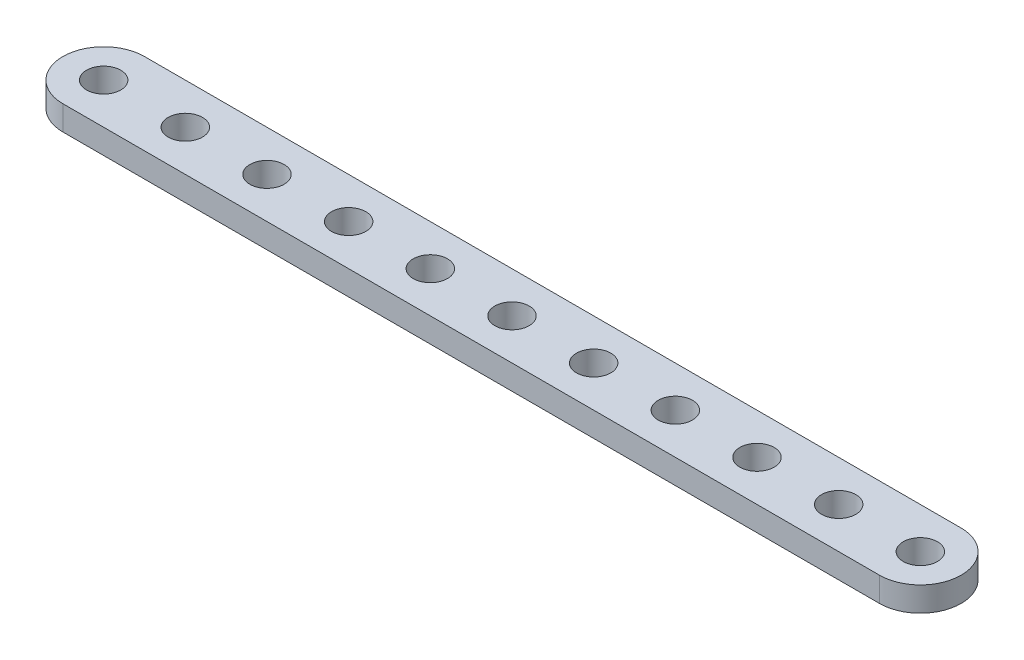
from build123d import *

# Parameters (mm, degrees)
SKETCH1_R           = 2.1
BOSS_EXTRUDE1_DEPTH = 1.5


with BuildPart() as part:
    # Sketch1 → Boss-Extrude1 (new, symmetric)
    with BuildSketch(Plane(origin=(0, 0, 0), x_dir=(1, 0, 0), z_dir=(0, 1, 0))):
        with BuildLine():
            Line((-50, 5), (50, 5))
            ThreePointArc((50, 5), (55, 0), (50, -5))
            Line((50, -5), (-50, -5))
            ThreePointArc((-50, -5), (-55, 0), (-50, 5))
        make_face()
        with Locations(Location((50, 0, 0), (0, 0, 270))):
            Circle(SKETCH1_R, mode=Mode.SUBTRACT)
        with Locations(Location((40, 0, 0), (0, 0, 270))):
            Circle(SKETCH1_R, mode=Mode.SUBTRACT)
        with Locations(Location((30, 0, 0), (0, 0, 270))):
            Circle(SKETCH1_R, mode=Mode.SUBTRACT)
        with Locations(Location((20, 0, 0), (0, 0, 270))):
            Circle(SKETCH1_R, mode=Mode.SUBTRACT)
        with Locations(Location((10, 0, 0), (0, 0, 270))):
            Circle(SKETCH1_R, mode=Mode.SUBTRACT)
        with Locations(Location((0, 0, 0), (0, 0, 270))):
            Circle(SKETCH1_R, mode=Mode.SUBTRACT)
        with Locations(Location((-10, 0, 0), (0, 0, 270))):
            Circle(SKETCH1_R, mode=Mode.SUBTRACT)
        with Locations(Location((-20, 0, 0), (0, 0, 270))):
            Circle(SKETCH1_R, mode=Mode.SUBTRACT)
        with Locations(Location((-30, 0, 0), (0, 0, 270))):
            Circle(SKETCH1_R, mode=Mode.SUBTRACT)
        with Locations(Location((-40, 0, 0), (0, 0, 270))):
            Circle(SKETCH1_R, mode=Mode.SUBTRACT)
        with Locations(Location((-50, 0, 0), (0, 0, 270))):
            Circle(SKETCH1_R, mode=Mode.SUBTRACT)
    extrude(amount=BOSS_EXTRUDE1_DEPTH, both=True)


solid = part.part
